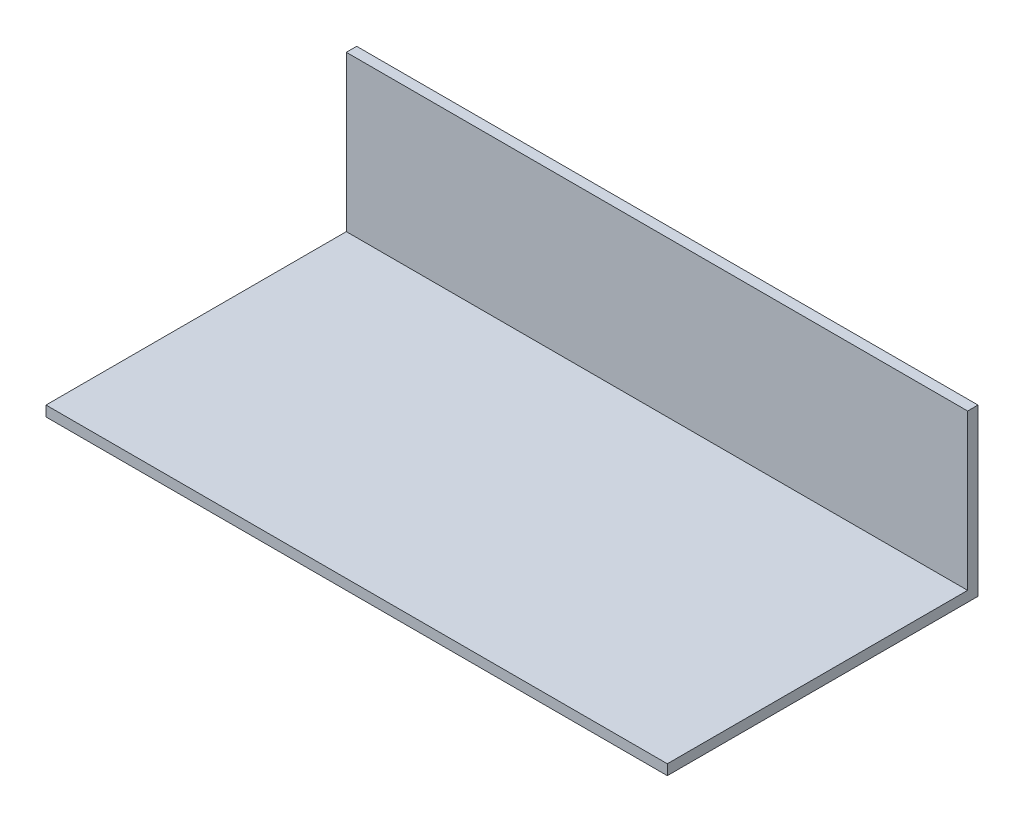
from build123d import *

# Parameters (mm, degrees)
SKETCH1_W           = 600
SKETCH1_H           = 300
BOSS_EXTRUDE1_DEPTH = 10
SKETCH2_W           = 600
SKETCH2_H           = 10
BOSS_EXTRUDE2_DEPTH = 150


with BuildPart() as part:
    # Sketch1 → Boss-Extrude1 (new body)
    with BuildSketch(Plane(origin=(0, 0, 0), x_dir=(1, 0, 0), z_dir=(0, 1, 0))):
        Rectangle(SKETCH1_W, SKETCH1_H)
    extrude(amount=BOSS_EXTRUDE1_DEPTH)

    # Sketch2 → Boss-Extrude2 (add)
    with BuildSketch(Plane(origin=(0, 10, 0), x_dir=(1, 0, 0), z_dir=(0, 1, 0))):
        with Locations((0, 145)):
            Rectangle(SKETCH2_W, SKETCH2_H)
    extrude(amount=BOSS_EXTRUDE2_DEPTH)


solid = part.part
